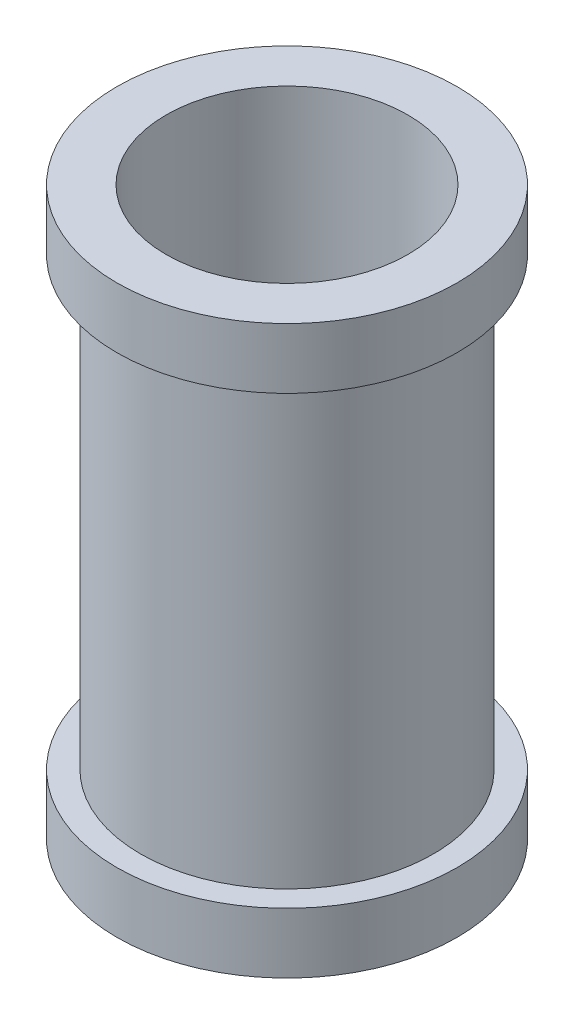
from build123d import *


with BuildPart() as part:
    # Sketch3 → Revolve1 (revolve)
    with BuildSketch(Plane.XY, mode=Mode.PRIVATE) as revolve1_sk:
        Polygon((0, 0), (8.255, 0), (8.255, 10.16), (4.28625, 10.16), (4.28625, 85.09), (8.255, 85.09), (8.255, 95.25), (0, 95.25), align=None)
    revolve(revolve1_sk.sketch.rotate(Axis((-20.32, 95.25, 0), (0, -1, 0)), 90), axis=Axis((-20.32, 95.25, 0), (0, -1, 0)))


solid = part.part
